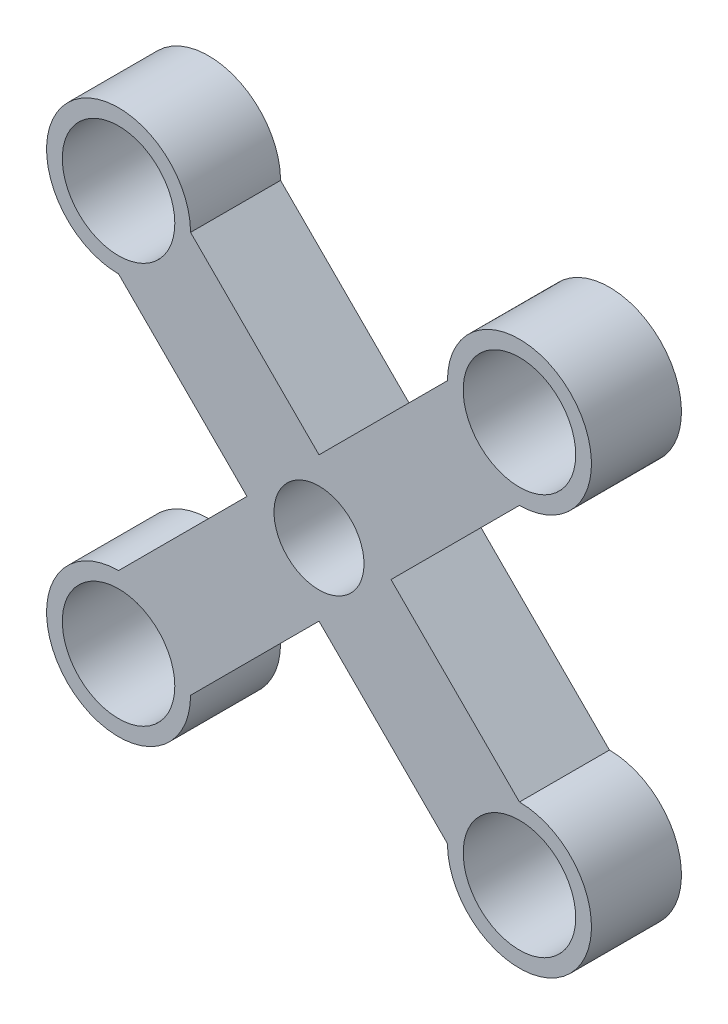
from build123d import *

# Parameters (mm, degrees)
SKETCH2_R           = 7.9375
SKETCH2_R_2         = 6.35
BOSS_EXTRUDE1_DEPTH = 12.7


with BuildPart() as part:
    # Sketch2 → Boss-Extrude1 (new body)
    with BuildSketch(Plane.XY):
        with BuildLine():
            Line((-28.210760469, -18.251004821), (-10.08654579, -0.126790143))
            Line((-10.08654579, -0.126790143), (-28.210760469, 17.997424536))
            ThreePointArc((-28.210760469, 17.997424536), (-35.394965366, 35.341629433), (-18.050760469, 28.157424536))
            Line((-18.050760469, 28.157424536), (0.07345421, 10.033209857))
            Line((0.07345421, 10.033209857), (18.197668889, 28.157424536))
            ThreePointArc((18.197668889, 28.157424536), (35.541873785, 35.341629433), (28.357668889, 17.997424536))
            Line((28.357668889, 17.997424536), (10.23345421, -0.126790143))
            Line((10.23345421, -0.126790143), (28.357668889, -18.251004821))
            ThreePointArc((28.357668889, -18.251004821), (35.541873785, -35.595209718), (18.197668889, -28.411004821))
            Line((18.197668889, -28.411004821), (0.07345421, -10.286790143))
            Line((0.07345421, -10.286790143), (-18.050760469, -28.411004821))
            ThreePointArc((-18.050760469, -28.411004821), (-35.394965366, -35.595209718), (-28.210760469, -18.251004821))
        make_face()
        with Locations((-28.210760469, 28.157424536)):
            Circle(SKETCH2_R, mode=Mode.SUBTRACT)
        with Locations((28.357668889, 28.157424536)):
            Circle(SKETCH2_R, mode=Mode.SUBTRACT)
        with Locations((28.357668889, -28.411004821)):
            Circle(SKETCH2_R, mode=Mode.SUBTRACT)
        with Locations((-28.210760469, -28.411004821)):
            Circle(SKETCH2_R, mode=Mode.SUBTRACT)
        with Locations((0.07345421, -0.126790143)):
            Circle(SKETCH2_R_2, mode=Mode.SUBTRACT)
    extrude(amount=BOSS_EXTRUDE1_DEPTH)


solid = part.part
